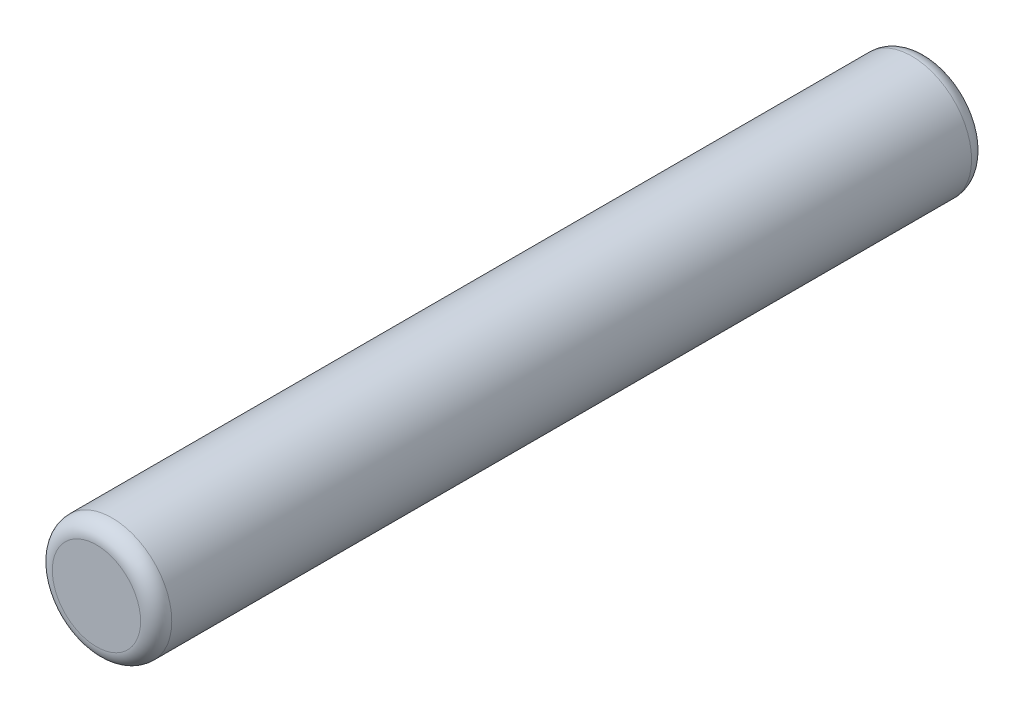
from build123d import *

# Parameters (mm, degrees)
ESBO_O1_R                = 1.15
RESSALTO_EXTRUS_O1_DEPTH = 16
FILETE1_R                = 0.3


with BuildPart() as part:
    # Esboço1 → Ressalto-extrusão1 (new body)
    with BuildSketch(Plane.XY):
        Circle(ESBO_O1_R)
    extrude(amount=RESSALTO_EXTRUS_O1_DEPTH)

    # Filete1
    filete1_edges = [part.edges().sort_by_distance(p)[0] for p in [
        (-1.15, 0, 0),
        (-1.15, 0, 16),
    ]]
    fillet(filete1_edges, radius=FILETE1_R)


solid = part.part
